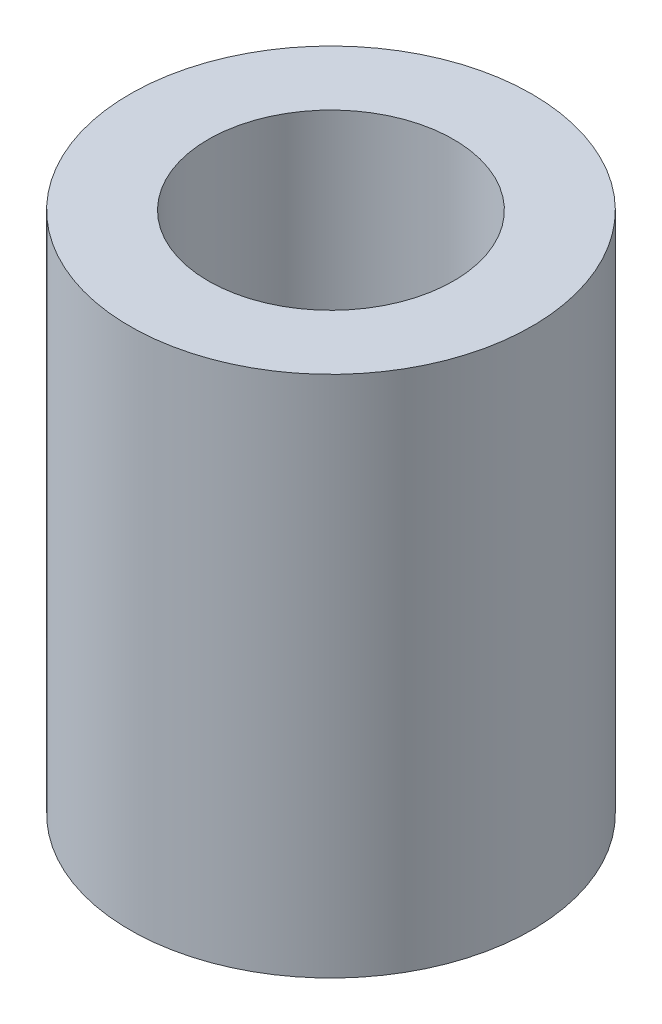
from build123d import *

# Parameters (mm, degrees)
SKETCH1_R           = 5
BOSS_EXTRUDE1_DEPTH = 6.5
SKETCH2_R           = 3.05
CUT_EXTRUDE1_DEPTH  = 15.798648587


with BuildPart() as part:
    # Sketch1 → Boss-Extrude1 (new, symmetric)
    with BuildSketch(Plane(origin=(0, 0, 0), x_dir=(1, 0, 0), z_dir=(0, 1, 0))):
        with Locations(Location((0, 0, 0), (0, 0, 90))):
            Circle(SKETCH1_R)
    extrude(amount=BOSS_EXTRUDE1_DEPTH, both=True)

    # Sketch2 → Cut-Extrude1 (cut, through all)
    with BuildSketch(Plane(origin=(0, 6.5, 0), x_dir=(1, 0, 0), z_dir=(0, 1, 0))):
        with Locations(Location((0, 0, 0), (0, 0, 270))):
            Circle(SKETCH2_R)
    extrude(amount=-CUT_EXTRUDE1_DEPTH, mode=Mode.SUBTRACT)


solid = part.part
